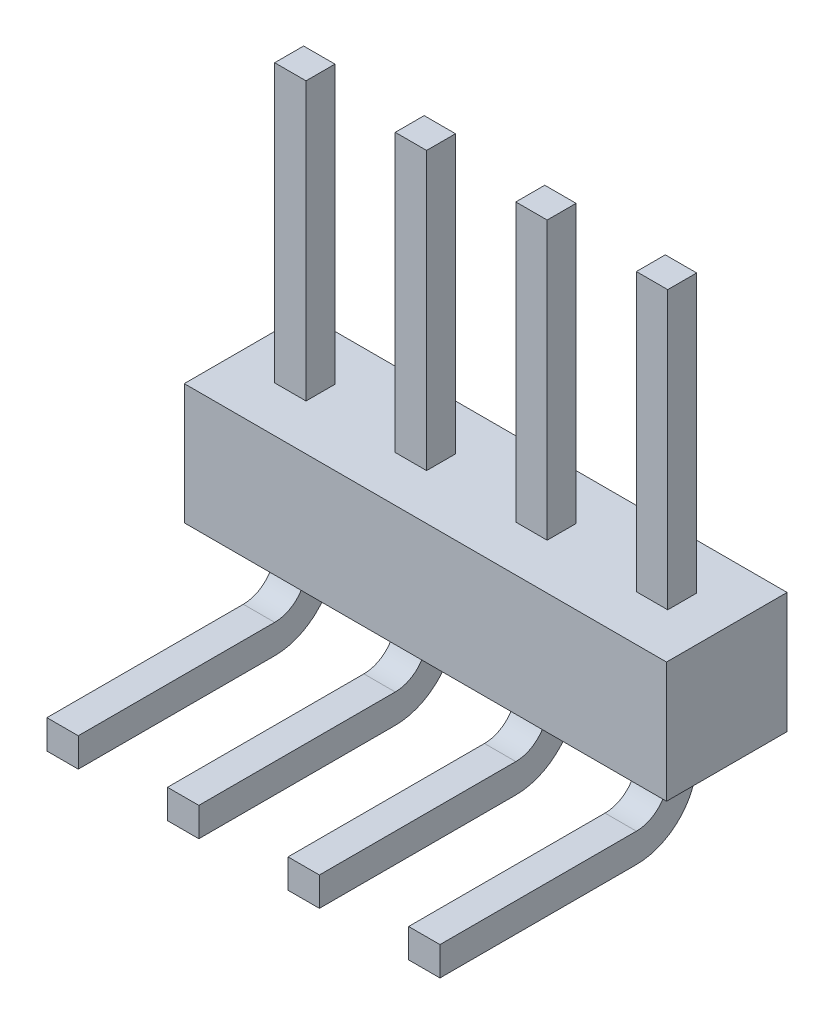
from build123d import *

# Parameters (mm, degrees)
SKETCH2_W           = 2.54
SKETCH2_H           = 2.54
BOSS_EXTRUDE1_DEPTH = 5.08
BOSS_EXTRUDE2_DEPTH = 0.3302
LPATTERN1_COUNT     = 4
LPATTERN1_PITCH     = 2.54


with BuildPart() as part:
    # Sketch2 → Boss-Extrude1 (new, symmetric)
    with BuildSketch(Plane(origin=(0, 0, 0), x_dir=(0, 0, -1), z_dir=(1, 0, 0))):
        Rectangle(SKETCH2_W, SKETCH2_H)
    extrude(amount=BOSS_EXTRUDE1_DEPTH, both=True)

    # Sketch3 → Boss-Extrude2 (add, symmetric)
    with BuildSketch(Plane(origin=(3.81, 0, 0), x_dir=(0, 0, -1), z_dir=(1, 0, 0))):
        with BuildLine():
            Line((-0.3048, 7.112), (-0.3048, -1.778))
            ThreePointArc((-0.3048, -1.778), (-0.498226682, -2.244973318), (-0.9652, -2.4384))
            Line((-0.9652, -2.4384), (-5.103190824, -2.4384))
            Line((-5.103190824, -2.4384), (-5.103190824, -3.048))
            Line((-5.103190824, -3.048), (-0.9652, -3.048))
            ThreePointArc((-0.9652, -3.048), (-0.067174388, -2.676025612), (0.3048, -1.778))
            Line((0.3048, -1.778), (0.3048, 7.112))
            Line((0.3048, 7.112), (-0.3048, 7.112))
        make_face()
    boss_extrude2 = extrude(amount=BOSS_EXTRUDE2_DEPTH, both=True)

    # LPattern1: Boss-Extrude2 ×4
    with Locations(*[(-i * LPATTERN1_PITCH, 0, 0) for i in range(1, LPATTERN1_COUNT)]):
        add(boss_extrude2)


solid = part.part
